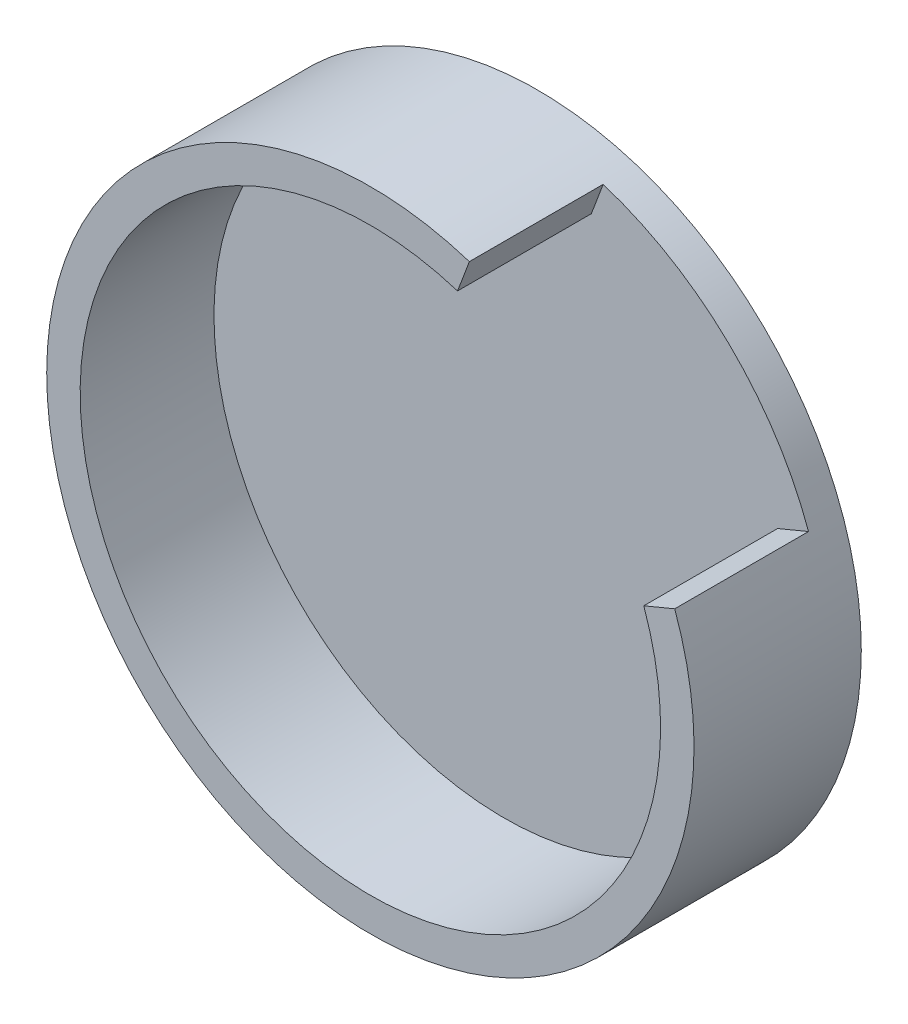
from build123d import *

# Parameters (mm, degrees)
CROQUIS1_R              = 19.35
SALIENTE_EXTRUIR1_DEPTH = 10
VACIADO1_T              = -2
CORTAR_EXTRUIR1_DEPTH   = 8


with BuildPart() as part:
    # Croquis1 → Saliente-Extruir1 (new body)
    with BuildSketch(Plane.XY):
        Circle(CROQUIS1_R)
    extrude(amount=SALIENTE_EXTRUIR1_DEPTH)

    # Vaciado1
    vaciado1_openings = [part.faces().sort_by_distance(p)[0] for p in [
        (0, 0, 10),
    ]]
    offset(amount=VACIADO1_T, openings=vaciado1_openings, kind=Kind.INTERSECTION)

    # Croquis2 → Cortar-Extruir1 (cut)
    with BuildSketch(Plane.XY.offset(10)):
        with BuildLine():
            Line((5.91867852, 18.42258789), (5.212083976, 16.548615671))
            ThreePointArc((5.212083976, 16.548615671), (11.920626225, 12.366173509), (16.346311037, 5.815549456))
            Line((16.346311037, 5.815549456), (18.195253679, 6.584469877))
            ThreePointArc((18.195253679, 6.584469877), (13.903068898, 14.418007159), (5.91867852, 18.42258789))
        make_face()
    extrude(amount=-CORTAR_EXTRUIR1_DEPTH, mode=Mode.SUBTRACT)


solid = part.part
